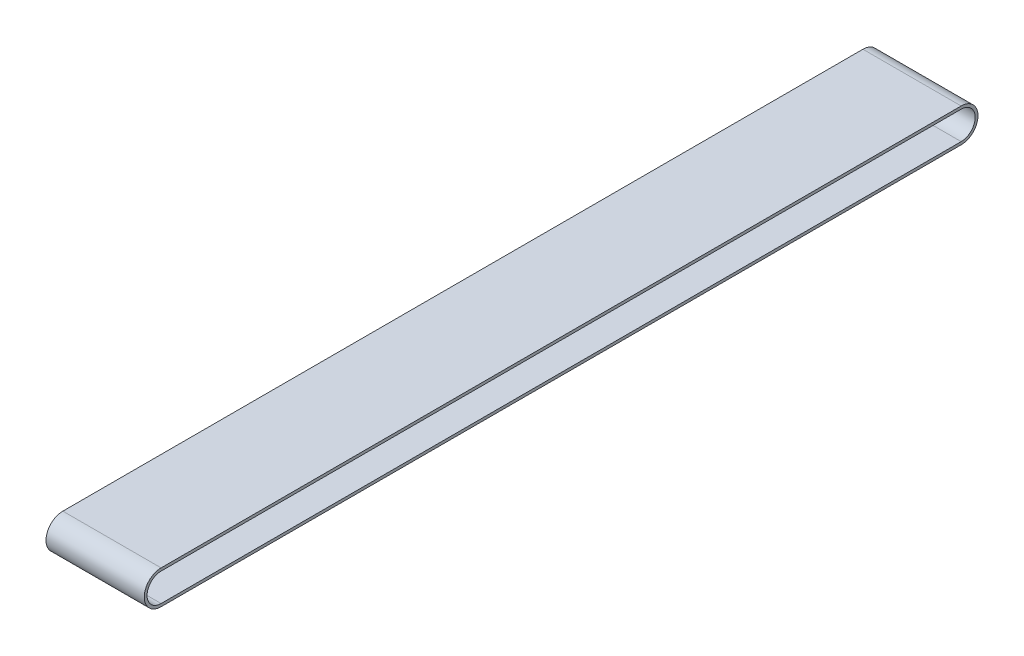
from build123d import *

# Parameters (mm, degrees)
BOSS_EXTRU_1_DEPTH = 350


with BuildPart() as part:
    # Esquisse1 → Boss.-Extru.1 (new body)
    with BuildSketch(Plane(origin=(0, 0, 0), x_dir=(0, 0, -1), z_dir=(1, 0, 0))):
        with BuildLine():
            Line((0, 60), (2850, 60))
            ThreePointArc((2850, 60), (2910, 0), (2850, -60))
            Line((2850, -60), (0, -60))
            ThreePointArc((0, -60), (-60, 0), (0, 60))
        make_face()
        with BuildLine():
            Line((0, 50), (2850, 50))
            ThreePointArc((2850, 50), (2900, 0), (2850, -50))
            Line((2850, -50), (0, -50))
            ThreePointArc((0, -50), (-50, 0), (0, 50))
        make_face(mode=Mode.SUBTRACT)
    extrude(amount=BOSS_EXTRU_1_DEPTH)


solid = part.part
